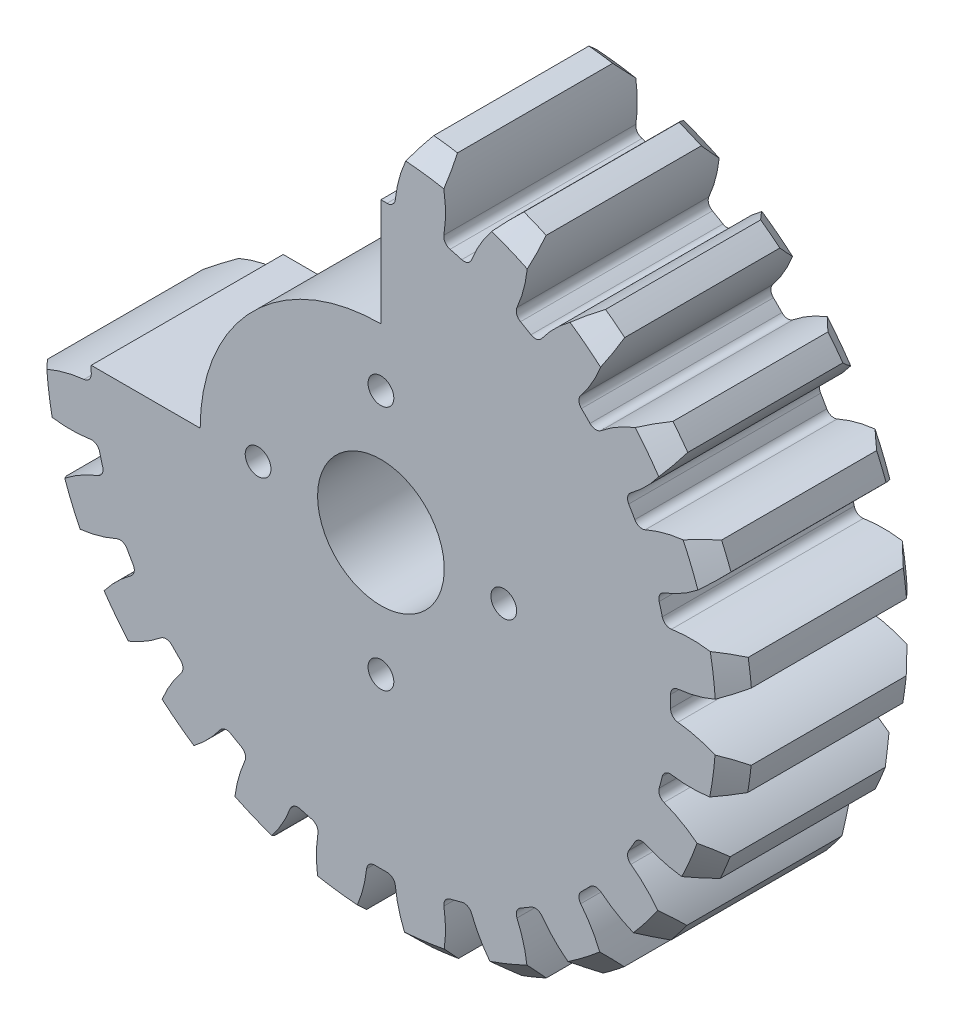
from build123d import *

# Parameters (mm, degrees)
SKETCH1_R                = 23.020833333
BOSS_EXTRUDE1_DEPTH      = 6.25
CUT_EXTRUDE1_DEPTH       = 35.873593659
FILLET1_R                = 0.53125
CHAMFER1_SIZE            = 1.2
CIRPATTERN2_COUNT        = 24
FILLET1_OF_CIRPATTERN2_R = 0.53125
SKETCH3_R                = 4.125
SKETCH3_R_2              = 0.838714545
CUT_EXTRUDE2_DEPTH       = 35.745461824
CUT_EXTRUDE3_DEPTH       = 35.745461824


with BuildPart() as part:
    # Sketch1 → Boss-Extrude1 (new, symmetric)
    with BuildSketch(Plane.XY):
        Circle(SKETCH1_R)
    extrude(amount=BOSS_EXTRUDE1_DEPTH, both=True)

    # Sketch2 → Cut-Extrude1 (cut, through all)
    with BuildSketch(Plane.XY.offset(6.25)):
        with BuildLine():
            ThreePointArc((0.896200177, 18.749426905), (0, 18.770833333), (-0.896200177, 18.749426905))
            ThreePointArc((-0.896200177, 18.749426905), (-1.29210701, 20.920212373), (-2.243277711, 22.911273916))
            ThreePointArc((-2.243277711, 22.911273916), (0, 23.020833333), (2.243277711, 22.911273916))
            ThreePointArc((2.243277711, 22.911273916), (1.29210701, 20.920212373), (0.896200177, 18.749426905))
        make_face()
    cut_extrude1 = extrude(amount=-CUT_EXTRUDE1_DEPTH, mode=Mode.SUBTRACT)

    # Fillet1
    fillet1_edges = [part.edges().sort_by_distance(p)[0] for p in [
        (0.896200177, 18.749426905, 0),
        (-0.896200177, 18.749426905, 0),
    ]]
    fillet(fillet1_edges, radius=FILLET1_R)

    # Chamfer1
    chamfer1_edges = [part.edges().sort_by_distance(p)[0] for p in [
        (0, -23.020833333, -6.25),
        (0, -23.020833333, 6.25),
    ]]
    chamfer(chamfer1_edges, length=CHAMFER1_SIZE)

    # CirPattern2: Cut-Extrude1 ×24 about axis
    cirpattern2_axis = Axis((0, -0.095694461, 0), (0, 0, 1))
    for i in range(1, CIRPATTERN2_COUNT):
        add(cut_extrude1.rotate(cirpattern2_axis, i * 360 / CIRPATTERN2_COUNT), mode=Mode.SUBTRACT)

    # Fillet1 of CirPattern2
    fillet1_of_cirpattern2_edges = [part.edges().sort_by_distance(p)[0] for p in [
        (-4.011813421, 18.33924864, 0),
        (-5.743139213, 17.875341292, 0),
        (-8.646428563, 16.672759468, 0),
        (-10.198692803, 15.776559291, 0),
        (-12.691803888, 13.863527871, 0),
        (-13.959222333, 12.596109427, 0),
        (-15.872253752, 10.102998342, 0),
        (-16.768453929, 8.550734102, 0),
        (-17.971035753, 5.647444752, 0),
        (-18.434943101, 3.91611896, 0),
        (-18.845121366, 0.800505715, 0),
        (-18.845121366, -0.991894638, 0),
        (-18.434943101, -4.107507882, 0),
        (-17.971035753, -5.838833674, 0),
        (-16.768453929, -8.742123025, 0),
        (-15.872253752, -10.294387264, 0),
        (-13.959222333, -12.787498349, 0),
        (-12.691803888, -14.054916794, 0),
        (-10.198692803, -15.967948214, 0),
        (-8.646428563, -16.86414839, 0),
        (-5.743139213, -18.066730215, 0),
        (-4.011813421, -18.530637562, 0),
        (-0.896200177, -18.940815828, 0),
        (0.896200177, -18.940815828, 0),
        (4.011813421, -18.530637562, 0),
        (5.743139213, -18.066730215, 0),
        (8.646428563, -16.86414839, 0),
        (10.198692803, -15.967948214, 0),
        (12.691803888, -14.054916794, 0),
        (13.959222333, -12.787498349, 0),
        (15.872253752, -10.294387264, 0),
        (16.768453929, -8.742123025, 0),
        (17.971035753, -5.838833674, 0),
        (18.434943101, -4.107507882, 0),
        (18.845121366, -0.991894638, 0),
        (18.845121366, 0.800505715, 0),
        (18.434943101, 3.91611896, 0),
        (17.971035753, 5.647444752, 0),
        (16.768453929, 8.550734102, 0),
        (15.872253752, 10.102998342, 0),
        (13.959222333, 12.596109427, 0),
        (12.691803888, 13.863527871, 0),
        (10.198692803, 15.776559291, 0),
        (8.646428563, 16.672759468, 0),
        (5.743139213, 17.875341292, 0),
        (4.011813421, 18.33924864, 0),
    ]]
    fillet(fillet1_of_cirpattern2_edges, radius=FILLET1_OF_CIRPATTERN2_R)

    # Sketch3 → Cut-Extrude2 (cut, through all)
    with BuildSketch(Plane(origin=(0, 0, -6.25), x_dir=(-1, 0, 0), z_dir=(0, 0, -1))):
        Circle(SKETCH3_R)
        with Locations((0, 8)):
            Circle(SKETCH3_R_2)
        with Locations((8, 0)):
            Circle(SKETCH3_R_2)
        with Locations((0, -8)):
            Circle(SKETCH3_R_2)
        with Locations((-8, 0)):
            Circle(SKETCH3_R_2)
    extrude(amount=-CUT_EXTRUDE2_DEPTH, mode=Mode.SUBTRACT)

    # Sketch4 → Cut-Extrude3 (cut, through all)
    with BuildSketch(Plane(origin=(0, 0, -6.25), x_dir=(-1, 0, 0), z_dir=(0, 0, -1))):
        with BuildLine():
            Line((11.770833333, 0), (23.020833333, 0))
            ThreePointArc((23.020833333, 0), (16.278187359, 16.278187359), (0, 23.020833333))
            Line((0, 23.020833333), (0, 11.770833333))
            ThreePointArc((0, 11.770833333), (8.32323607, 8.32323607), (11.770833333, 0))
        make_face()
    extrude(amount=-CUT_EXTRUDE3_DEPTH, mode=Mode.SUBTRACT)


solid = part.part
